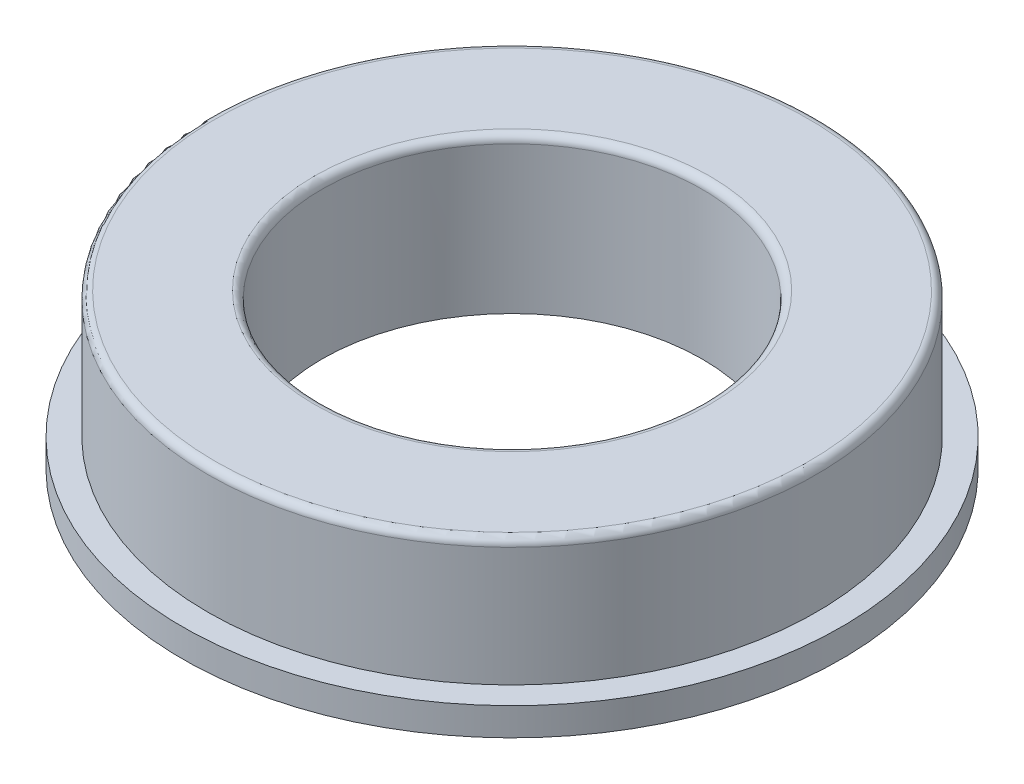
from build123d import *

# Parameters (mm, degrees)
SKETCH_2_R          = 13
EXTRUDE_1_DEPTH     = 1.1
CUT_EXTRUDE_1_REACH = 21.053
SKETCH_3_R          = 7.5


with BuildPart() as part:
    # 草图1 → 旋转1 (revolve)
    with BuildSketch(Plane(origin=(0, 0, 0), x_dir=(-1, 0, 0), z_dir=(0, 0, -1)), mode=Mode.PRIVATE) as revolve_1_sk:
        with BuildLine():
            Line((-11.7, 0), (-7.8, 0))
            Line((-7.8, 0), (-7.5, 0))
            Line((-7.5, 0), (-7.5, 0.3))
            Line((-7.5, 0.3), (-7.5, 4.7))
            ThreePointArc((-7.5, 4.7), (-7.587867966, 4.912132034), (-7.8, 5))
            Line((-7.8, 5), (-11.7, 5))
            ThreePointArc((-11.7, 5), (-11.912132034, 4.912132034), (-12, 4.7))
            Line((-12, 4.7), (-12, 0.3))
            Line((-12, 0.3), (-12, 0))
            Line((-12, 0), (-11.7, 0))
        make_face()
    revolve(revolve_1_sk.sketch.rotate(Axis((0, -0.001250002, 0), (0, 1, 0)), 270), axis=Axis((0, -0.001250002, 0), (0, 1, 0)))

    # 草图2 → 凸台-拉伸1 (add)
    with BuildSketch(Plane.XZ):
        with Locations(Location((0, 0, 0), (0, 0, 270))):
            Circle(SKETCH_2_R)
    extrude(amount=EXTRUDE_1_DEPTH)

    # 草图3 → 切除-拉伸1 (cut, up to next)
    with BuildSketch(Plane(origin=(0, 0, 0), x_dir=(1, 0, 0), z_dir=(0, 1, 0)), mode=Mode.PRIVATE) as cut_extrude_1_sk1:
        with Locations(Location((0, 0, 0), (0, 0, 270))):
            Circle(SKETCH_3_R)
    cut_extrude_1_tool1 = extrude(cut_extrude_1_sk1.sketch, amount=-CUT_EXTRUDE_1_REACH, mode=Mode.PRIVATE) & part.part
    add(cut_extrude_1_tool1.solids().sort_by_distance((0, 0, 0))[0], mode=Mode.SUBTRACT)


solid = part.part
